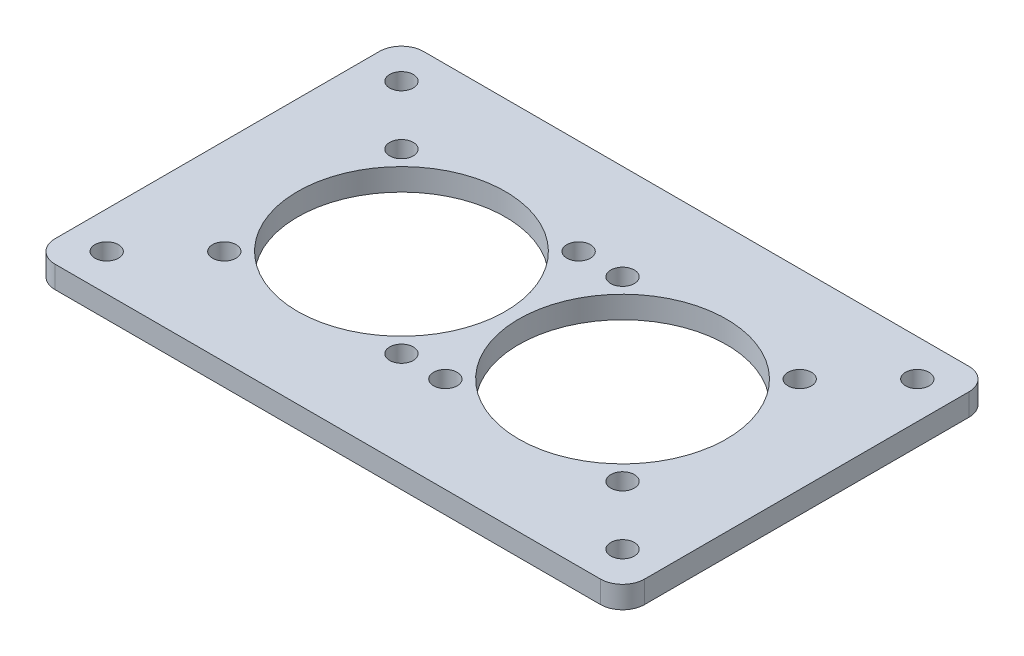
from build123d import *

# Parameters (mm, degrees)
SKETCH_1_W          = 60
SKETCH_1_H          = 30
EXTRUDE_1_DEPTH     = 30
SKETCH_2_W          = 60
SKETCH_2_H          = 30
CUT_EXTRUDE_1_DEPTH = 27
SKETCH_3_R          = 1.6
SKETCH_3_R_2        = 14.1
CUT_EXTRUDE_2_DEPTH = 43.532340636
SKETCH_4_W          = 80
SKETCH_4_H          = 50
SKETCH_4_W_2        = 60
SKETCH_4_H_2        = 30
EXTRUDE_2_DEPTH     = 3
SKETCH_5_R          = 1.6
CUT_EXTRUDE_3_DEPTH = 3
FILLET_1_R          = 3


with BuildPart() as part:
    # 草图1 → 凸台-拉伸1 (new body)
    with BuildSketch(Plane.XY):
        Rectangle(SKETCH_1_W, SKETCH_1_H)
    extrude(amount=EXTRUDE_1_DEPTH)

    # 草图2 → 切除-拉伸1 (cut)
    with BuildSketch(Plane.XZ.offset(15)):
        with Locations((0, 15)):
            Rectangle(SKETCH_2_W, SKETCH_2_H)
    extrude(amount=-CUT_EXTRUDE_1_DEPTH, mode=Mode.SUBTRACT)

    # 草图3 → 切除-拉伸2 (cut, through all)
    with BuildSketch(Plane(origin=(0, 15, 0), x_dir=(1, 0, 0), z_dir=(0, 1, 0))):
        with Locations(Location((-27.02081528, -2.97918472, 0), (0, 0, 270))):
            Circle(SKETCH_3_R)
        with Locations(Location((-2.97918472, -2.97918472, 0), (0, 0, 270))):
            Circle(SKETCH_3_R)
        with Locations(Location((-2.97918472, -27.02081528, 0), (0, 0, 270))):
            Circle(SKETCH_3_R)
        with Locations(Location((-27.02081528, -27.02081528, 0), (0, 0, 270))):
            Circle(SKETCH_3_R)
        with Locations(Location((27.02081528, -27.02081528, 0), (0, 0, 90))):
            Circle(SKETCH_3_R)
        with Locations(Location((2.97918472, -27.02081528, 0), (0, 0, 90))):
            Circle(SKETCH_3_R)
        with Locations(Location((2.97918472, -2.97918472, 0), (0, 0, 90))):
            Circle(SKETCH_3_R)
        with Locations(Location((27.02081528, -2.97918472, 0), (0, 0, 90))):
            Circle(SKETCH_3_R)
        with Locations(Location((-15, -15, 0), (0, 0, 270))):
            Circle(SKETCH_3_R_2)
        with Locations(Location((15, -15, 0), (0, 0, 270))):
            Circle(SKETCH_3_R_2)
    extrude(amount=-CUT_EXTRUDE_2_DEPTH, mode=Mode.SUBTRACT)

    # 草图4 → 凸台-拉伸2 (add)
    with BuildSketch(Plane(origin=(0, 15, 0), x_dir=(1, 0, 0), z_dir=(0, 1, 0))):
        with Locations((0, -15)):
            Rectangle(SKETCH_4_W, SKETCH_4_H)
        with Locations((0, -15)):
            Rectangle(SKETCH_4_W_2, SKETCH_4_H_2, mode=Mode.SUBTRACT)
    extrude(amount=-EXTRUDE_2_DEPTH)

    # 草图5 → 切除-拉伸3 (cut)
    with BuildSketch(Plane(origin=(0, 15, 0), x_dir=(1, 0, 0), z_dir=(0, 1, 0))):
        with Locations(Location((-35, 5, 0), (0, 0, 270))):
            Circle(SKETCH_5_R)
        with Locations(Location((35, 5, 0), (0, 0, 270))):
            Circle(SKETCH_5_R)
        with Locations(Location((35, -35, 0), (0, 0, 270))):
            Circle(SKETCH_5_R)
        with Locations(Location((-35, -35, 0), (0, 0, 270))):
            Circle(SKETCH_5_R)
    extrude(amount=-CUT_EXTRUDE_3_DEPTH, mode=Mode.SUBTRACT)

    # 圆角1
    fillet_1_edges = [part.edges().sort_by_distance(p)[0] for p in [
        (40, 13.5, -10),
        (40, 13.5, 40),
        (-40, 13.5, 40),
        (-40, 13.5, -10),
    ]]
    fillet(fillet_1_edges, radius=FILLET_1_R)


solid = part.part
